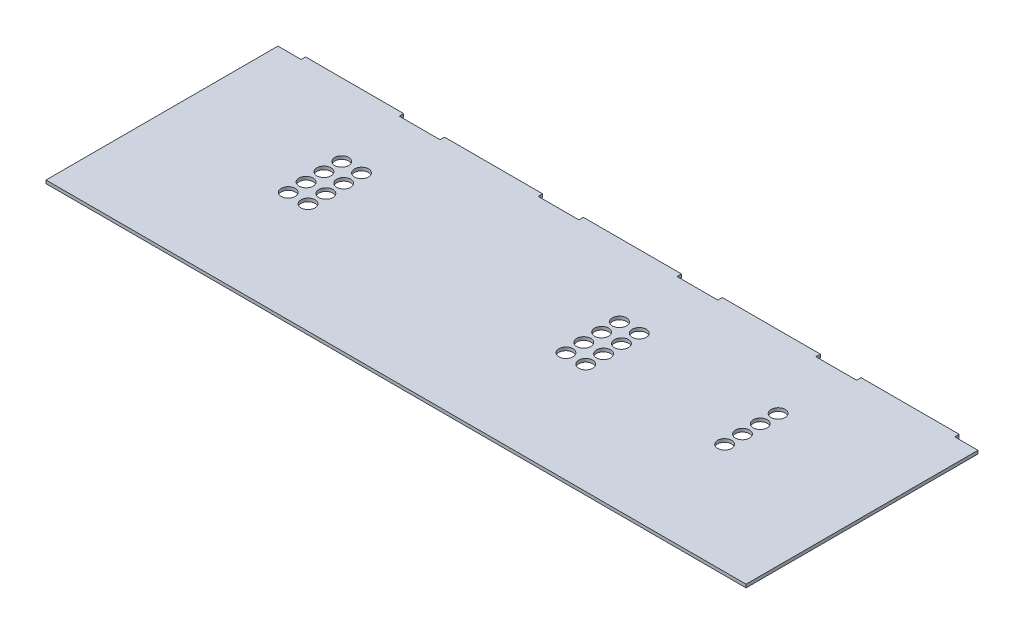
from build123d import *

# Parameters (mm, degrees)
SKETCH1_W           = 498.348
SKETCH1_H           = 165.1
BOSS_EXTRUDE1_DEPTH = 1.143
SKETCH2_W           = 69.85
SKETCH2_H           = 2.286
BOSS_EXTRUDE2_DEPTH = 3.175
LPATTERN1_COUNT     = 5
LPATTERN1_PITCH     = 98.8568
SKETCH3_R           = 5
CUT_EXTRUDE1_DEPTH  = 264.517900145


with BuildPart() as part:
    # Sketch1 → Boss-Extrude1 (new, symmetric)
    with BuildSketch(Plane(origin=(0, 0, 0), x_dir=(1, 0, 0), z_dir=(0, 1, 0))):
        Rectangle(SKETCH1_W, SKETCH1_H)
    extrude(amount=BOSS_EXTRUDE1_DEPTH, both=True)

    # Sketch2 → Boss-Extrude2 (add)
    with BuildSketch(Plane(origin=(0, 0, -82.55), x_dir=(-1, 0, 0), z_dir=(0, 0, -1))):
        with Locations((-197.7136, 0)):
            Rectangle(SKETCH2_W, SKETCH2_H)
    boss_extrude2 = extrude(amount=BOSS_EXTRUDE2_DEPTH)

    # LPattern1: Boss-Extrude2 ×5
    with Locations(*[(-i * LPATTERN1_PITCH, 0, 0) for i in range(1, LPATTERN1_COUNT)]):
        add(boss_extrude2)

    # Sketch3 → Cut-Extrude1 (cut, through all)
    with BuildSketch(Plane.XZ.offset(1.143)):
        with Locations(Location((-155.3337, 3.9751, 0), (0, 0, 270))):
            Circle(SKETCH3_R)
        with Locations(Location((-141.2367, 3.9751, 0), (0, 0, 270))):
            Circle(SKETCH3_R)
        with Locations(Location((-141.2367, -8.7249, 0), (0, 0, 270))):
            Circle(SKETCH3_R)
        with Locations(Location((-155.3337, -8.7249, 0), (0, 0, 270))):
            Circle(SKETCH3_R)
        with Locations(Location((-141.2367, -21.4249, 0), (0, 0, 270))):
            Circle(SKETCH3_R)
        with Locations(Location((-155.3337, -21.4249, 0), (0, 0, 270))):
            Circle(SKETCH3_R)
        with Locations(Location((-141.2367, -34.1249, 0), (0, 0, 270))):
            Circle(SKETCH3_R)
        with Locations(Location((-155.3337, -34.1249, 0), (0, 0, 270))):
            Circle(SKETCH3_R)
        with Locations(Location((56.4769, 3.9751, 0), (0, 0, 270))):
            Circle(SKETCH3_R)
        with Locations(Location((56.4769, -8.7249, 0), (0, 0, 270))):
            Circle(SKETCH3_R)
        with Locations(Location((42.3799, 3.9751, 0), (0, 0, 270))):
            Circle(SKETCH3_R)
        with Locations(Location((42.3799, -8.7249, 0), (0, 0, 270))):
            Circle(SKETCH3_R)
        with Locations(Location((56.4769, -21.4249, 0), (0, 0, 270))):
            Circle(SKETCH3_R)
        with Locations(Location((42.3799, -21.4249, 0), (0, 0, 270))):
            Circle(SKETCH3_R)
        with Locations(Location((56.4769, -34.1249, 0), (0, 0, 270))):
            Circle(SKETCH3_R)
        with Locations(Location((42.3799, -34.1249, 0), (0, 0, 270))):
            Circle(SKETCH3_R)
        with Locations(Location((155.3337, 3.9751, 0), (0, 0, 270))):
            Circle(SKETCH3_R)
        with Locations(Location((155.3337, -8.7249, 0), (0, 0, 270))):
            Circle(SKETCH3_R)
        with Locations(Location((155.3337, -21.4249, 0), (0, 0, 270))):
            Circle(SKETCH3_R)
        with Locations(Location((155.3337, -34.1249, 0), (0, 0, 270))):
            Circle(SKETCH3_R)
    extrude(amount=-CUT_EXTRUDE1_DEPTH, mode=Mode.SUBTRACT)


solid = part.part
